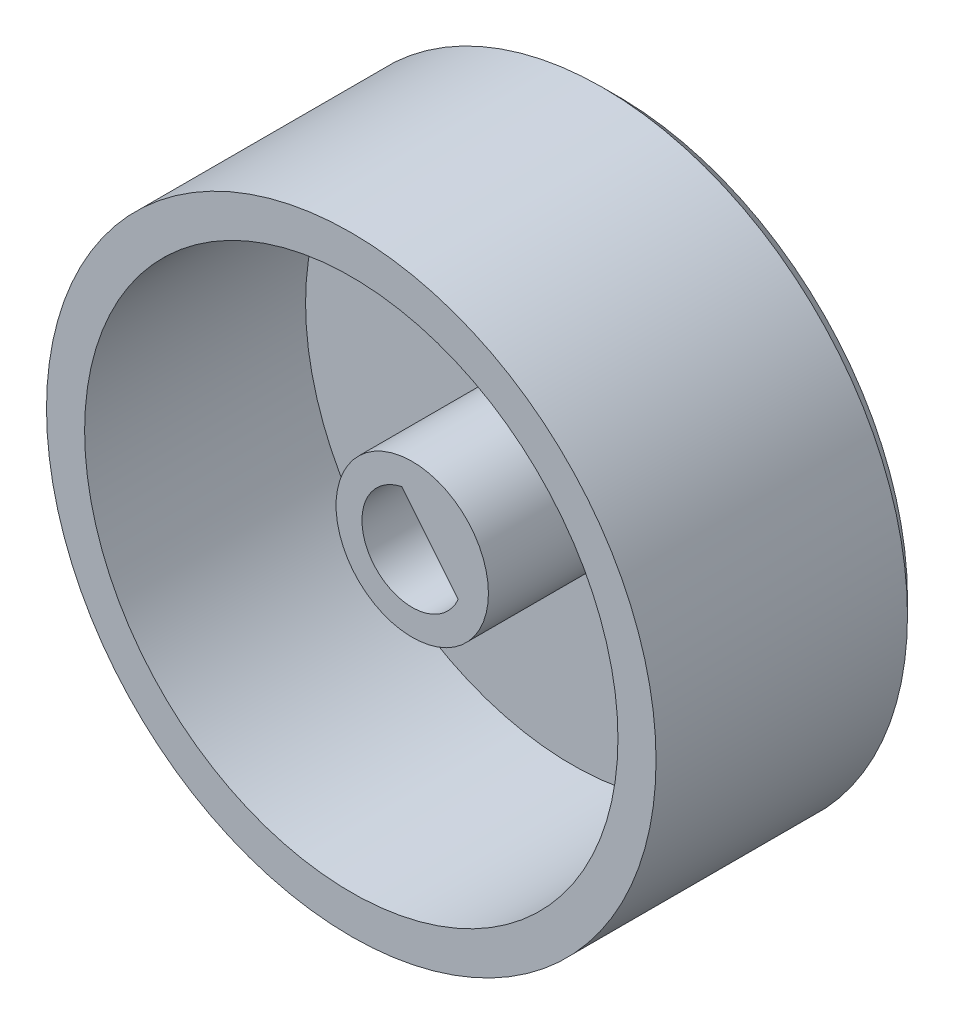
from build123d import *

# Parameters (mm, degrees)
SKETCH1_R           = 20
BOSS_EXTRUDE1_DEPTH = 15
SKETCH2_R           = 17.5
SKETCH2_R_2         = 5
CUT_EXTRUDE1_DEPTH  = 12
CUT_EXTRUDE2_DEPTH  = 10.5
SKETCH4_R           = 5
CUT_EXTRUDE3_DEPTH  = 1.5
CHAMFER1_SIZE       = 1
SKETCH7_R           = 20
SKETCH7_R_2         = 17.5
BOSS_EXTRUDE2_DEPTH = 2.5


with BuildPart() as part:
    # Sketch1 → Boss-Extrude1 (new body)
    with BuildSketch(Plane.XY):
        Circle(SKETCH1_R)
    extrude(amount=BOSS_EXTRUDE1_DEPTH)

    # Sketch2 → Cut-Extrude1 (cut)
    with BuildSketch(Plane.XY.offset(15)):
        Circle(SKETCH2_R)
        Circle(SKETCH2_R_2, mode=Mode.SUBTRACT)
    extrude(amount=-CUT_EXTRUDE1_DEPTH, mode=Mode.SUBTRACT)

    # Sketch3 → Cut-Extrude2 (cut)
    with BuildSketch(Plane.XY.offset(15)):
        with BuildLine():
            Line((-0.682606966, 3.228629389), (3.014916342, -1.341744927))
            ThreePointArc((3.014916342, -1.341744927), (-2.565540314, -2.075572908), (-0.682606966, 3.228629389))
        make_face()
    extrude(amount=-CUT_EXTRUDE2_DEPTH, mode=Mode.SUBTRACT)

    # Sketch4 → Cut-Extrude3 (cut)
    with BuildSketch(Plane.XY.offset(15)):
        Circle(SKETCH4_R)
    extrude(amount=-CUT_EXTRUDE3_DEPTH, mode=Mode.SUBTRACT)

    # Chamfer1
    chamfer1_edges = [part.edges().sort_by_distance(p)[0] for p in [
        (-20, 0, 0),
    ]]
    chamfer(chamfer1_edges, length=CHAMFER1_SIZE)

    # Sketch7 → Boss-Extrude2 (add)
    with BuildSketch(Plane.XY.offset(15)):
        Circle(SKETCH7_R)
        Circle(SKETCH7_R_2, mode=Mode.SUBTRACT)
    extrude(amount=BOSS_EXTRUDE2_DEPTH)


solid = part.part
